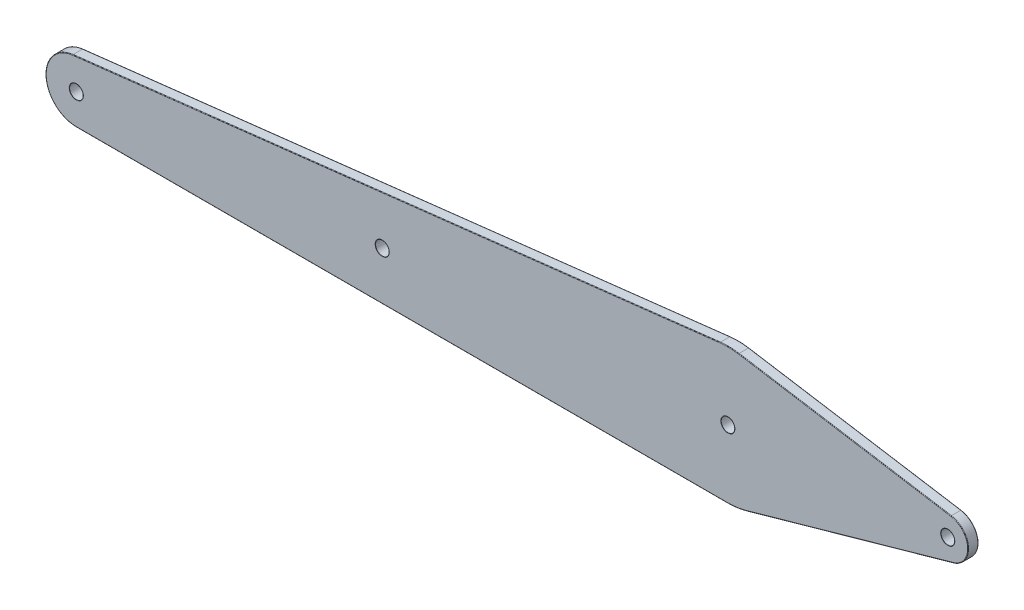
from build123d import *

# Parameters (mm, degrees)
BOSS_EXTRUDE1_DEPTH        = 3
M3_5_CLEARANCE_HOLE1_D     = 3.9
M3_5_CLEARANCE_HOLE1_DEPTH = 10
M3_5_CLEARANCE_HOLE1_TIP   = 1.171678207
FILLET1_R                  = 0.15
SKETCH_1_R                 = 2
CUT_EXTRUDE_1_DEPTH        = 10
SKETCH_2_R                 = 2
CUT_EXTRUDE_2_DEPTH        = 10
SKETCH_3_R                 = 2
CUT_EXTRUDE_3_DEPTH        = 10


with BuildPart() as part:
    # Sketch1 → Boss-Extrude1 (new body)
    with BuildSketch(Plane.XY):
        with BuildLine():
            Line((-14.983034782, 186.331852937), (45.907666819, 203.517965313))
            ThreePointArc((45.907666819, 203.517965313), (50.268013149, 209.636120617), (45.236403893, 215.215309872))
            Line((45.236403893, 215.215309872), (-17.220577868, 225.323001467))
            ThreePointArc((-17.220577868, 225.323001467), (-19.957763668, 225.574627364), (-22.703599252, 225.448577215))
            Line((-22.703599252, 225.448577215), (-213.129889679, 203.520788586))
            ThreePointArc((-213.129889679, 203.520788586), (-221.085550876, 194.064245617), (-212.100333524, 185.579870617))
            Line((-212.100333524, 185.579870617), (-20.415696686, 185.579870617))
            ThreePointArc((-20.415696686, 185.579870617), (-17.673467083, 185.76875816), (-14.983034782, 186.331852937))
        make_face()
    extrude(amount=-BOSS_EXTRUDE1_DEPTH)

    # M3.5 Clearance Hole1
    with Locations(Plane.XY):
        with Locations((44.277868248, 209.292370617), (-20.415696686, 205.579870617), (-52.165696686, -1330.164308971), (-122.100333524, 199.744603777), (-212.100333524, 194.579870617)):
            Hole(M3_5_CLEARANCE_HOLE1_D / 2, depth=M3_5_CLEARANCE_HOLE1_DEPTH)
            with Locations((0, 0, -(M3_5_CLEARANCE_HOLE1_DEPTH + M3_5_CLEARANCE_HOLE1_TIP / 2))):  # 118° drill point
                Cone(0, M3_5_CLEARANCE_HOLE1_D / 2, M3_5_CLEARANCE_HOLE1_TIP, mode=Mode.SUBTRACT)

    # Fillet1
    fillet1_edges = [part.edges().sort_by_distance(p)[0] for p in [
        (50.268013149, 209.636120617, -3),
        (15.462316019, 194.924909125, 0),
        (-17.673467083, 185.76875816, 0),
        (14.007913013, 220.26915567, -3),
        (-19.957763668, 225.574627364, -3),
        (-117.916744466, 214.4846829, -3),
        (-221.085550876, 194.064245617, -3),
        (-116.258015105, 185.579870617, -3),
        (-210.150333524, 194.579870617, -3),
        (-210.150333524, 194.579870617, 0),
        (-120.150333524, 199.744603777, -3),
        (-120.150333524, 199.744603777, 0),
        (-18.465696686, 205.579870617, -3),
        (-18.465696686, 205.579870617, 0),
        (-17.673467083, 185.76875816, -3),
        (46.227868248, 209.292370617, -3),
        (46.227868248, 209.292370617, 0),
        (15.462316019, 194.924909125, -3),
        (-116.258015105, 185.579870617, 0),
        (-221.085550876, 194.064245617, 0),
        (-117.916744466, 214.4846829, 0),
        (-19.957763668, 225.574627364, 0),
        (14.007913013, 220.26915567, 0),
        (50.268013149, 209.636120617, 0),
    ]]
    fillet(fillet1_edges, radius=FILLET1_R)

    # 草图1 → 切除-拉伸1 (cut)
    with BuildSketch(Plane.XY):
        with Locations((-20.415696686, 205.579870617)):
            Circle(SKETCH_1_R)
    extrude(amount=-CUT_EXTRUDE_1_DEPTH, mode=Mode.SUBTRACT)

    # 草图2 → 切除-拉伸2 (cut)
    with BuildSketch(Plane.XY):
        with Locations((44.277868248, 209.292370617)):
            Circle(SKETCH_2_R)
    extrude(amount=-CUT_EXTRUDE_2_DEPTH, mode=Mode.SUBTRACT)

    # 草图3 → 切除-拉伸3 (cut)
    with BuildSketch(Plane.XY):
        with Locations((-122.100333524, 199.744603777)):
            Circle(SKETCH_3_R)
        with Locations((-212.100333524, 194.579870617)):
            Circle(SKETCH_3_R)
    extrude(amount=-CUT_EXTRUDE_3_DEPTH, mode=Mode.SUBTRACT)


solid = part.part
